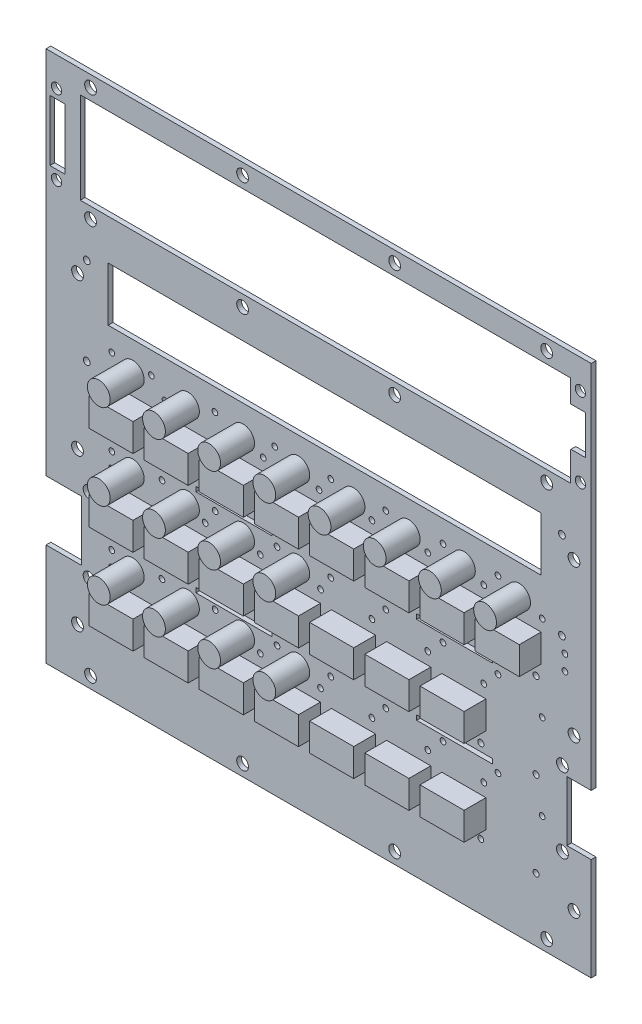
from build123d import *

# Parameters (mm, degrees)
SKETCH1_W                       = 144.56156
SKETCH1_H                       = 18.00098
SKETCH1_W_2                     = 5.08
SKETCH1_H_2                     = 20.32
SKETCH1_W_3                     = 25.4
SKETCH1_H_3                     = 1.5875
BOARD_DEPTH                     = 1.592072
SKETCH11_R                      = 3.81
LED_KINGBRIGHT_3P_2P54_10_DEPTH = 11.3538
SKETCH12_R                      = 3.81
LED_KINGBRIGHT_3P_2P54_11_DEPTH = 11.3538
SKETCH13_R                      = 3.81
LED_KINGBRIGHT_3P_2P54_12_DEPTH = 11.3538
SKETCH14_R                      = 3.81
LED_KINGBRIGHT_3P_2P54_13_DEPTH = 11.3538
SKETCH15_R                      = 3.81
LED_KINGBRIGHT_3P_2P54_14_DEPTH = 11.3538
SKETCH16_R                      = 3.81
LED_KINGBRIGHT_3P_2P54_15_DEPTH = 11.3538
SKETCH17_R                      = 3.81
LED_KINGBRIGHT_3P_2P54_16_DEPTH = 11.3538
SKETCH18_R                      = 3.81
LED_KINGBRIGHT_3P_2P54_17_DEPTH = 11.3538
SKETCH19_R                      = 3.81
LED_KINGBRIGHT_3P_2P54_18_DEPTH = 11.3538
SKETCH20_R                      = 3.81
LED_KINGBRIGHT_3P_2P54_19_DEPTH = 11.3538
SKETCH21_R                      = 3.81
LED_KINGBRIGHT_3P_2P54_20_DEPTH = 11.3538
SKETCH22_R                      = 3.81
LED_KINGBRIGHT_3P_2P54_21_DEPTH = 11.3538
SKETCH23_R                      = 3.81
LED_KINGBRIGHT_3P_2P54_22_DEPTH = 11.3538
SKETCH24_R                      = 3.81
LED_KINGBRIGHT_3P_2P54_23_DEPTH = 11.3538
SKETCH25_R                      = 3.81
LED_KINGBRIGHT_3P_2P54_24_DEPTH = 11.3538
SKETCH26_R                      = 3.81
LED_KINGBRIGHT_3P_2P54_25_DEPTH = 11.3538
SKETCH29_W                      = 14.732
SKETCH29_H                      = 9.271
SWITCH_MCDTS2_3_DEPTH           = 7.3000108
SKETCH30_W                      = 14.732
SKETCH30_H                      = 9.271
SWITCH_MCDTS2_4_DEPTH           = 7.3000108
SKETCH31_W                      = 14.732
SKETCH31_H                      = 9.271
SWITCH_MCDTS2_5_DEPTH           = 7.3000108
SKETCH32_W                      = 14.732
SKETCH32_H                      = 9.271
SWITCH_MCDTS2_6_DEPTH           = 7.3000108
SKETCH33_W                      = 14.732
SKETCH33_H                      = 9.271
SWITCH_MCDTS2_7_DEPTH           = 7.3000108
SKETCH34_W                      = 14.732
SKETCH34_H                      = 9.271
SWITCH_MCDTS2_8_DEPTH           = 7.3000108
SKETCH35_W                      = 14.732
SKETCH35_H                      = 9.271
SWITCH_MCDTS2_9_DEPTH           = 7.3000108
SKETCH36_W                      = 14.732
SKETCH36_H                      = 9.271
SWITCH_MCDTS2_10_DEPTH          = 7.3000108
SKETCH37_W                      = 14.732
SKETCH37_H                      = 9.271
SWITCH_MCDTS2_11_DEPTH          = 7.3000108
SKETCH38_W                      = 14.732
SKETCH38_H                      = 9.271
SWITCH_MCDTS2_12_DEPTH          = 7.3000108
SKETCH39_W                      = 14.732
SKETCH39_H                      = 9.271
SWITCH_MCDTS2_13_DEPTH          = 7.3000108
SKETCH40_W                      = 14.732
SKETCH40_H                      = 9.271
SWITCH_MCDTS2_14_DEPTH          = 7.3000108
SKETCH41_W                      = 14.732
SKETCH41_H                      = 9.271
SWITCH_MCDTS2_15_DEPTH          = 7.3000108
SKETCH42_W                      = 14.732
SKETCH42_H                      = 9.271
SWITCH_MCDTS2_16_DEPTH          = 7.3000108
SKETCH43_W                      = 14.732
SKETCH43_H                      = 9.271
SWITCH_MCDTS2_17_DEPTH          = 7.3000108
SKETCH44_W                      = 14.732
SKETCH44_H                      = 9.271
SWITCH_MCDTS2_18_DEPTH          = 7.3000108
SKETCH45_W                      = 14.732
SKETCH45_H                      = 9.271
SWITCH_MCDTS2_19_DEPTH          = 7.3000108
SKETCH46_W                      = 14.732
SKETCH46_H                      = 9.271
SWITCH_MCDTS2_20_DEPTH          = 7.3000108
SKETCH47_W                      = 14.732
SKETCH47_H                      = 9.271
SWITCH_MCDTS2_21_DEPTH          = 7.3000108
SKETCH48_W                      = 14.732
SKETCH48_H                      = 9.271
SWITCH_MCDTS2_22_DEPTH          = 7.3000108
SKETCH49_W                      = 14.732
SKETCH49_H                      = 9.271
SWITCH_MCDTS2_23_DEPTH          = 7.3000108
SKETCH50_W                      = 14.732
SKETCH50_H                      = 9.271
SWITCH_MCDTS2_24_DEPTH          = 7.3000108
SKETCH56_R                      = 1.016
SKETCH56_R_2                    = 0.9652
SKETCH56_R_3                    = 0.9525
SKETCH56_R_4                    = 1.9685
SKETCH56_R_5                    = 1.1303
SKETCH56_R_6                    = 1.7145
CUT_EXTRUDE1_DEPTH              = 10


with BuildPart() as part:
    # Sketch1 → BOARD (new body)
    with BuildSketch(Plane.XY):
        Polygon((0, 0), (182.118, 0), (182.118, 34.24682), (173.98746, 34.24682), (173.98746, 54.24678), (182.118, 54.24678), (182.118, 177.8), (0, 177.8), (0, 54.24678), (11.86942, 54.24678), (11.86942, 34.24682), (0, 34.24682), align=None)
        with Locations((93.01988, 117.17909)):
            Rectangle(SKETCH1_W, SKETCH1_H, mode=Mode.SUBTRACT)
        with Locations((3.81, 154.813)):
            Rectangle(SKETCH1_W_2, SKETCH1_H_2, mode=Mode.SUBTRACT)
        Polygon((12.7, 170.18), (175.26, 170.18), (175.26, 162.6616), (180.086, 162.6616), (180.2892, 162.4584), (180.2892, 149.606), (175.3616, 149.606), (175.26, 149.5044), (175.26, 139.7), (12.7, 139.7), (11.43, 139.7), (11.43, 170.18), align=None, mode=Mode.SUBTRACT)
        with Locations((62.7634, 46.20895)):
            Rectangle(SKETCH1_W_3, SKETCH1_H_3, mode=Mode.SUBTRACT)
        with Locations((136.5134176, 46.20895)):
            Rectangle(SKETCH1_W_3, SKETCH1_H_3, mode=Mode.SUBTRACT)
        with Locations((136.5134176, 75.41895)):
            Rectangle(SKETCH1_W_3, SKETCH1_H_3, mode=Mode.SUBTRACT)
        with Locations((62.7634, 75.41895)):
            Rectangle(SKETCH1_W_3, SKETCH1_H_3, mode=Mode.SUBTRACT)
    extrude(amount=BOARD_DEPTH)

    # Sketch56 → Cut-Extrude1 (cut)
    with BuildSketch(Plane.XY.offset(1.592072)):
        with Locations((163.703, 21.1074)):
            Circle(SKETCH56_R)
        with Locations((163.703, 49.6824)):
            Circle(SKETCH56_R)
        with Locations((145.2626, 21.8186)):
            Circle(SKETCH56_R_2)
        with Locations((126.8476, 21.6154)):
            Circle(SKETCH56_R_2)
        with Locations((108.4072, 21.7424)):
            Circle(SKETCH56_R_2)
        with Locations((89.9668, 21.844)):
            Circle(SKETCH56_R_2)
        with Locations((71.5264, 20.7772)):
            Circle(SKETCH56_R_2)
        with Locations((53.086, 21.1582)):
            Circle(SKETCH56_R_2)
        with Locations((34.6472002, 21.1328)):
            Circle(SKETCH56_R)
        with Locations((145.2626, 49.5554)):
            Circle(SKETCH56_R)
        with Locations((126.8222, 49.3522)):
            Circle(SKETCH56_R)
        with Locations((108.3818, 49.1236)):
            Circle(SKETCH56_R)
        with Locations((89.9414, 49.6824)):
            Circle(SKETCH56_R)
        with Locations((71.501, 49.1998)):
            Circle(SKETCH56_R)
        with Locations((53.0606, 49.1998)):
            Circle(SKETCH56_R)
        with Locations((34.6202, 49.276)):
            Circle(SKETCH56_R)
        with Locations((163.703, 78.2574)):
            Circle(SKETCH56_R)
        with Locations((145.2626, 77.7748)):
            Circle(SKETCH56_R)
        with Locations((126.746, 78.3336)):
            Circle(SKETCH56_R)
        with Locations((108.3818, 78.74)):
            Circle(SKETCH56_R)
        with Locations((89.9414, 78.3336)):
            Circle(SKETCH56_R)
        with Locations((71.501, 78.2574)):
            Circle(SKETCH56_R)
        with Locations((53.0606, 78.4098)):
            Circle(SKETCH56_R)
        with Locations((34.6202, 78.0542)):
            Circle(SKETCH56_R)
        with Locations((91.694, 38.6588)):
            Circle(SKETCH56_R_3)
        with Locations((77.1652, 43.7388)):
            Circle(SKETCH56_R_3)
        with Locations((71.5772, 38.6588)):
            Circle(SKETCH56_R_3)
        with Locations((56.4896, 43.7388)):
            Circle(SKETCH56_R_3)
        with Locations((38.735, 43.7388)):
            Circle(SKETCH56_R_3)
        with Locations((21.8948, 38.6588)):
            Circle(SKETCH56_R_3)
        with Locations((21.971, 43.7388)):
            Circle(SKETCH56_R_3)
        with Locations((77.1652, 72.3138)):
            Circle(SKETCH56_R_3)
        with Locations((91.694, 67.2338)):
            Circle(SKETCH56_R_3)
        with Locations((71.5772, 67.2338)):
            Circle(SKETCH56_R_3)
        with Locations((56.4896, 72.3138)):
            Circle(SKETCH56_R_3)
        with Locations((53.1368, 67.2338)):
            Circle(SKETCH56_R_3)
        with Locations((38.735, 72.3138)):
            Circle(SKETCH56_R_3)
        with Locations((21.8948, 67.2338)):
            Circle(SKETCH56_R_3)
        with Locations((21.971, 72.3138)):
            Circle(SKETCH56_R_3)
        with Locations((165.735, 95.8088)):
            Circle(SKETCH56_R_3)
        with Locations((150.9776, 100.8888)):
            Circle(SKETCH56_R_3)
        with Locations((146.2278, 95.8088)):
            Circle(SKETCH56_R_3)
        with Locations((132.6134, 100.8888)):
            Circle(SKETCH56_R_3)
        with Locations((113.4872, 100.8888)):
            Circle(SKETCH56_R_3)
        with Locations((127.508, 95.8088)):
            Circle(SKETCH56_R_3)
        with Locations((108.8644, 95.8088)):
            Circle(SKETCH56_R_3)
        with Locations((95.0976, 100.8888)):
            Circle(SKETCH56_R_3)
        with Locations((91.186, 95.8088)):
            Circle(SKETCH56_R_3)
        with Locations((76.3778, 100.8888)):
            Circle(SKETCH56_R_3)
        with Locations((72.5424, 95.8088)):
            Circle(SKETCH56_R_3)
        with Locations((56.4134, 100.8888)):
            Circle(SKETCH56_R_3)
        with Locations((39.7256, 95.8088)):
            Circle(SKETCH56_R_3)
        with Locations((35.179, 100.8888)):
            Circle(SKETCH56_R_3)
        with Locations((24.2062, 95.8088)):
            Circle(SKETCH56_R_3)
        with Locations((21.971, 100.8888)):
            Circle(SKETCH56_R_3)
        with Locations((132.6134, 72.3138)):
            Circle(SKETCH56_R_3)
        with Locations((146.2278, 67.2338)):
            Circle(SKETCH56_R_3)
        with Locations((113.4872, 72.3138)):
            Circle(SKETCH56_R_3)
        with Locations((127.508, 67.2338)):
            Circle(SKETCH56_R_3)
        with Locations((95.0976, 72.3138)):
            Circle(SKETCH56_R_3)
        with Locations((108.8644, 67.2338)):
            Circle(SKETCH56_R_3)
        with Locations((150.9776, 43.7388)):
            Circle(SKETCH56_R_3)
        with Locations((132.6134, 43.7388)):
            Circle(SKETCH56_R_3)
        with Locations((113.4872, 43.7388)):
            Circle(SKETCH56_R_3)
        with Locations((95.0976, 43.7388)):
            Circle(SKETCH56_R_3)
        with Locations((108.8644, 38.6588)):
            Circle(SKETCH56_R_3)
        with Locations((150.9776, 72.3138)):
            Circle(SKETCH56_R_3)
        with Locations((165.735, 67.2338)):
            Circle(SKETCH56_R_3)
        with Locations((173.3296, 89.4588)):
            Circle(SKETCH56_R_3)
        with Locations((173.355, 84.3534)):
            Circle(SKETCH56_R_3)
        with Locations((176.37252, 118.11)):
            Circle(SKETCH56_R_4)
        with Locations((176.37252, 67.31)):
            Circle(SKETCH56_R_4)
        with Locations((176.37252, 16.51)):
            Circle(SKETCH56_R_4)
        with Locations((167.259, 135.89)):
            Circle(SKETCH56_R_4)
        with Locations((116.459, 135.89)):
            Circle(SKETCH56_R_4)
        with Locations((65.659, 135.89)):
            Circle(SKETCH56_R_4)
        with Locations((14.859, 135.89)):
            Circle(SKETCH56_R_4)
        with Locations((10.51052, 118.11)):
            Circle(SKETCH56_R_4)
        with Locations((10.51052, 67.31)):
            Circle(SKETCH56_R_4)
        with Locations((10.51052, 16.51)):
            Circle(SKETCH56_R_4)
        with Locations((165.735, 38.6588)):
            Circle(SKETCH56_R_3)
        with Locations((146.2278, 38.6588)):
            Circle(SKETCH56_R_3)
        with Locations((127.508, 38.6588)):
            Circle(SKETCH56_R_3)
        with Locations((14.859, 173.99)):
            Circle(SKETCH56_R_4)
        with Locations((65.659, 173.99)):
            Circle(SKETCH56_R_4)
        with Locations((116.459, 173.99)):
            Circle(SKETCH56_R_4)
        with Locations((167.259, 173.99)):
            Circle(SKETCH56_R_4)
        with Locations((167.259, 3.81)):
            Circle(SKETCH56_R_4)
        with Locations((116.459, 3.81)):
            Circle(SKETCH56_R_4)
        with Locations((65.659, 3.81)):
            Circle(SKETCH56_R_4)
        with Locations((14.859, 3.81)):
            Circle(SKETCH56_R_4)
        with Locations((172.50664, 56.7436)):
            Circle(SKETCH56_R_4)
        with Locations((172.50664, 31.75)):
            Circle(SKETCH56_R_4)
        with Locations((14.36878, 56.7436)):
            Circle(SKETCH56_R_4)
        with Locations((14.36878, 31.75)):
            Circle(SKETCH56_R_4)
        with Locations((172.34154, 123.37542)):
            Circle(SKETCH56_R_5)
        with Locations((172.34154, 94.16542)):
            Circle(SKETCH56_R_5)
        with Locations((13.59154, 94.16542)):
            Circle(SKETCH56_R_5)
        with Locations((13.59154, 123.37542)):
            Circle(SKETCH56_R_5)
        with Locations((178.51374, 141.56182)):
            Circle(SKETCH56_R_6)
        with Locations((178.51374, 168.06164)):
            Circle(SKETCH56_R_6)
        with Locations((3.50012, 168.06164)):
            Circle(SKETCH56_R_6)
        with Locations((3.50012, 141.56182)):
            Circle(SKETCH56_R_6)
    extrude(amount=-CUT_EXTRUDE1_DEPTH, mode=Mode.SUBTRACT)


with BuildPart() as body_2:
    # Sketch11 → LED-KINGBRIGHT_3P_2P54-10 (new body)
    with BuildSketch(Plane.XY.offset(1.592072)):
        with Locations((84.2812132, 41.1988)):
            Circle(SKETCH11_R)
    extrude(amount=LED_KINGBRIGHT_3P_2P54_10_DEPTH)


with BuildPart() as body_3:
    # Sketch12 → LED-KINGBRIGHT_3P_2P54-11 (new body)
    with BuildSketch(Plane.XY.offset(1.592072)):
        with Locations((65.8437088, 41.1988)):
            Circle(SKETCH12_R)
    extrude(amount=LED_KINGBRIGHT_3P_2P54_11_DEPTH)


with BuildPart() as body_4:
    # Sketch13 → LED-KINGBRIGHT_3P_2P54-12 (new body)
    with BuildSketch(Plane.XY.offset(1.592072)):
        with Locations((47.4062044, 41.1988)):
            Circle(SKETCH13_R)
    extrude(amount=LED_KINGBRIGHT_3P_2P54_12_DEPTH)


with BuildPart() as body_5:
    # Sketch14 → LED-KINGBRIGHT_3P_2P54-13 (new body)
    with BuildSketch(Plane.XY.offset(1.592072)):
        with Locations((28.9687, 41.1988)):
            Circle(SKETCH14_R)
    extrude(amount=LED_KINGBRIGHT_3P_2P54_13_DEPTH)


with BuildPart() as body_6:
    # Sketch15 → LED-KINGBRIGHT_3P_2P54-14 (new body)
    with BuildSketch(Plane.XY.offset(1.592072)):
        with Locations((84.2812132, 69.7738)):
            Circle(SKETCH15_R)
    extrude(amount=LED_KINGBRIGHT_3P_2P54_14_DEPTH)


with BuildPart() as body_7:
    # Sketch16 → LED-KINGBRIGHT_3P_2P54-15 (new body)
    with BuildSketch(Plane.XY.offset(1.592072)):
        with Locations((65.8437088, 69.7738)):
            Circle(SKETCH16_R)
    extrude(amount=LED_KINGBRIGHT_3P_2P54_15_DEPTH)


with BuildPart() as body_8:
    # Sketch17 → LED-KINGBRIGHT_3P_2P54-16 (new body)
    with BuildSketch(Plane.XY.offset(1.592072)):
        with Locations((47.4062044, 69.7738)):
            Circle(SKETCH17_R)
    extrude(amount=LED_KINGBRIGHT_3P_2P54_16_DEPTH)


with BuildPart() as body_9:
    # Sketch18 → LED-KINGBRIGHT_3P_2P54-17 (new body)
    with BuildSketch(Plane.XY.offset(1.592072)):
        with Locations((28.9687, 69.7738)):
            Circle(SKETCH18_R)
    extrude(amount=LED_KINGBRIGHT_3P_2P54_17_DEPTH)


with BuildPart() as body_10:
    # Sketch19 → LED-KINGBRIGHT_3P_2P54-18 (new body)
    with BuildSketch(Plane.XY.offset(1.592072)):
        with Locations((158.0312308, 98.3488)):
            Circle(SKETCH19_R)
    extrude(amount=LED_KINGBRIGHT_3P_2P54_18_DEPTH)


with BuildPart() as body_11:
    # Sketch20 → LED-KINGBRIGHT_3P_2P54-19 (new body)
    with BuildSketch(Plane.XY.offset(1.592072)):
        with Locations((139.5937264, 98.3488)):
            Circle(SKETCH20_R)
    extrude(amount=LED_KINGBRIGHT_3P_2P54_19_DEPTH)


with BuildPart() as body_12:
    # Sketch21 → LED-KINGBRIGHT_3P_2P54-20 (new body)
    with BuildSketch(Plane.XY.offset(1.592072)):
        with Locations((121.156222, 98.3488)):
            Circle(SKETCH21_R)
    extrude(amount=LED_KINGBRIGHT_3P_2P54_20_DEPTH)


with BuildPart() as body_13:
    # Sketch22 → LED-KINGBRIGHT_3P_2P54-21 (new body)
    with BuildSketch(Plane.XY.offset(1.592072)):
        with Locations((102.7187176, 98.3488)):
            Circle(SKETCH22_R)
    extrude(amount=LED_KINGBRIGHT_3P_2P54_21_DEPTH)


with BuildPart() as body_14:
    # Sketch23 → LED-KINGBRIGHT_3P_2P54-22 (new body)
    with BuildSketch(Plane.XY.offset(1.592072)):
        with Locations((84.2812132, 98.3488)):
            Circle(SKETCH23_R)
    extrude(amount=LED_KINGBRIGHT_3P_2P54_22_DEPTH)


with BuildPart() as body_15:
    # Sketch24 → LED-KINGBRIGHT_3P_2P54-23 (new body)
    with BuildSketch(Plane.XY.offset(1.592072)):
        with Locations((65.8437088, 98.3488)):
            Circle(SKETCH24_R)
    extrude(amount=LED_KINGBRIGHT_3P_2P54_23_DEPTH)


with BuildPart() as body_16:
    # Sketch25 → LED-KINGBRIGHT_3P_2P54-24 (new body)
    with BuildSketch(Plane.XY.offset(1.592072)):
        with Locations((47.4062044, 98.3488)):
            Circle(SKETCH25_R)
    extrude(amount=LED_KINGBRIGHT_3P_2P54_24_DEPTH)


with BuildPart() as body_17:
    # Sketch26 → LED-KINGBRIGHT_3P_2P54-25 (new body)
    with BuildSketch(Plane.XY.offset(1.592072)):
        with Locations((28.9687, 98.3488)):
            Circle(SKETCH26_R)
    extrude(amount=LED_KINGBRIGHT_3P_2P54_25_DEPTH)


with BuildPart() as body_18:
    # Sketch29 → SWITCH-MCDTS2-3 (new body)
    with BuildSketch(Plane.XY.offset(1.592072)):
        with Locations((139.5937264, 29.9593)):
            Rectangle(SKETCH29_W, SKETCH29_H)
    extrude(amount=SWITCH_MCDTS2_3_DEPTH)


with BuildPart() as body_19:
    # Sketch30 → SWITCH-MCDTS2-4 (new body)
    with BuildSketch(Plane.XY.offset(1.592072)):
        with Locations((121.156222, 29.9593)):
            Rectangle(SKETCH30_W, SKETCH30_H)
    extrude(amount=SWITCH_MCDTS2_4_DEPTH)


with BuildPart() as body_20:
    # Sketch31 → SWITCH-MCDTS2-5 (new body)
    with BuildSketch(Plane.XY.offset(1.592072)):
        with Locations((102.7187176, 29.9593)):
            Rectangle(SKETCH31_W, SKETCH31_H)
    extrude(amount=SWITCH_MCDTS2_5_DEPTH)


with BuildPart() as body_21:
    # Sketch32 → SWITCH-MCDTS2-6 (new body)
    with BuildSketch(Plane.XY.offset(1.592072)):
        with Locations((84.2812132, 29.9593)):
            Rectangle(SKETCH32_W, SKETCH32_H)
    extrude(amount=SWITCH_MCDTS2_6_DEPTH)


with BuildPart() as body_22:
    # Sketch33 → SWITCH-MCDTS2-7 (new body)
    with BuildSketch(Plane.XY.offset(1.592072)):
        with Locations((65.8437088, 29.9593)):
            Rectangle(SKETCH33_W, SKETCH33_H)
    extrude(amount=SWITCH_MCDTS2_7_DEPTH)


with BuildPart() as body_23:
    # Sketch34 → SWITCH-MCDTS2-8 (new body)
    with BuildSketch(Plane.XY.offset(1.592072)):
        with Locations((47.4062044, 29.9593)):
            Rectangle(SKETCH34_W, SKETCH34_H)
    extrude(amount=SWITCH_MCDTS2_8_DEPTH)


with BuildPart() as body_24:
    # Sketch35 → SWITCH-MCDTS2-9 (new body)
    with BuildSketch(Plane.XY.offset(1.592072)):
        with Locations((28.9687, 29.9593)):
            Rectangle(SKETCH35_W, SKETCH35_H)
    extrude(amount=SWITCH_MCDTS2_9_DEPTH)


with BuildPart() as body_25:
    # Sketch36 → SWITCH-MCDTS2-10 (new body)
    with BuildSketch(Plane.XY.offset(1.592072)):
        with Locations((139.5937264, 58.5343)):
            Rectangle(SKETCH36_W, SKETCH36_H)
    extrude(amount=SWITCH_MCDTS2_10_DEPTH)


with BuildPart() as body_26:
    # Sketch37 → SWITCH-MCDTS2-11 (new body)
    with BuildSketch(Plane.XY.offset(1.592072)):
        with Locations((121.156222, 58.5343)):
            Rectangle(SKETCH37_W, SKETCH37_H)
    extrude(amount=SWITCH_MCDTS2_11_DEPTH)


with BuildPart() as body_27:
    # Sketch38 → SWITCH-MCDTS2-12 (new body)
    with BuildSketch(Plane.XY.offset(1.592072)):
        with Locations((102.7187176, 58.5343)):
            Rectangle(SKETCH38_W, SKETCH38_H)
    extrude(amount=SWITCH_MCDTS2_12_DEPTH)


with BuildPart() as body_28:
    # Sketch39 → SWITCH-MCDTS2-13 (new body)
    with BuildSketch(Plane.XY.offset(1.592072)):
        with Locations((84.2812132, 58.5343)):
            Rectangle(SKETCH39_W, SKETCH39_H)
    extrude(amount=SWITCH_MCDTS2_13_DEPTH)


with BuildPart() as body_29:
    # Sketch40 → SWITCH-MCDTS2-14 (new body)
    with BuildSketch(Plane.XY.offset(1.592072)):
        with Locations((65.8437088, 58.5343)):
            Rectangle(SKETCH40_W, SKETCH40_H)
    extrude(amount=SWITCH_MCDTS2_14_DEPTH)


with BuildPart() as body_30:
    # Sketch41 → SWITCH-MCDTS2-15 (new body)
    with BuildSketch(Plane.XY.offset(1.592072)):
        with Locations((47.4062044, 58.5343)):
            Rectangle(SKETCH41_W, SKETCH41_H)
    extrude(amount=SWITCH_MCDTS2_15_DEPTH)


with BuildPart() as body_31:
    # Sketch42 → SWITCH-MCDTS2-16 (new body)
    with BuildSketch(Plane.XY.offset(1.592072)):
        with Locations((28.9687, 58.5343)):
            Rectangle(SKETCH42_W, SKETCH42_H)
    extrude(amount=SWITCH_MCDTS2_16_DEPTH)


with BuildPart() as body_32:
    # Sketch43 → SWITCH-MCDTS2-17 (new body)
    with BuildSketch(Plane.XY.offset(1.592072)):
        with Locations((158.0312308, 87.1093)):
            Rectangle(SKETCH43_W, SKETCH43_H)
    extrude(amount=SWITCH_MCDTS2_17_DEPTH)


with BuildPart() as body_33:
    # Sketch44 → SWITCH-MCDTS2-18 (new body)
    with BuildSketch(Plane.XY.offset(1.592072)):
        with Locations((139.5937264, 87.1093)):
            Rectangle(SKETCH44_W, SKETCH44_H)
    extrude(amount=SWITCH_MCDTS2_18_DEPTH)


with BuildPart() as body_34:
    # Sketch45 → SWITCH-MCDTS2-19 (new body)
    with BuildSketch(Plane.XY.offset(1.592072)):
        with Locations((121.156222, 87.1093)):
            Rectangle(SKETCH45_W, SKETCH45_H)
    extrude(amount=SWITCH_MCDTS2_19_DEPTH)


with BuildPart() as body_35:
    # Sketch46 → SWITCH-MCDTS2-20 (new body)
    with BuildSketch(Plane.XY.offset(1.592072)):
        with Locations((102.7187176, 87.1093)):
            Rectangle(SKETCH46_W, SKETCH46_H)
    extrude(amount=SWITCH_MCDTS2_20_DEPTH)


with BuildPart() as body_36:
    # Sketch47 → SWITCH-MCDTS2-21 (new body)
    with BuildSketch(Plane.XY.offset(1.592072)):
        with Locations((84.2812132, 87.1093)):
            Rectangle(SKETCH47_W, SKETCH47_H)
    extrude(amount=SWITCH_MCDTS2_21_DEPTH)


with BuildPart() as body_37:
    # Sketch48 → SWITCH-MCDTS2-22 (new body)
    with BuildSketch(Plane.XY.offset(1.592072)):
        with Locations((65.8437088, 87.1093)):
            Rectangle(SKETCH48_W, SKETCH48_H)
    extrude(amount=SWITCH_MCDTS2_22_DEPTH)


with BuildPart() as body_38:
    # Sketch49 → SWITCH-MCDTS2-23 (new body)
    with BuildSketch(Plane.XY.offset(1.592072)):
        with Locations((47.4062044, 87.1093)):
            Rectangle(SKETCH49_W, SKETCH49_H)
    extrude(amount=SWITCH_MCDTS2_23_DEPTH)


with BuildPart() as body_39:
    # Sketch50 → SWITCH-MCDTS2-24 (new body)
    with BuildSketch(Plane.XY.offset(1.592072)):
        with Locations((28.9687, 87.1093)):
            Rectangle(SKETCH50_W, SKETCH50_H)
    extrude(amount=SWITCH_MCDTS2_24_DEPTH)


solid = Compound([part.part, body_2.part, body_3.part, body_4.part, body_5.part, body_6.part, body_7.part, body_8.part, body_9.part, body_10.part, body_11.part, body_12.part, body_13.part, body_14.part, body_15.part, body_16.part, body_17.part, body_18.part, body_19.part, body_20.part, body_21.part, body_22.part, body_23.part, body_24.part, body_25.part, body_26.part, body_27.part, body_28.part, body_29.part, body_30.part, body_31.part, body_32.part, body_33.part, body_34.part, body_35.part, body_36.part, body_37.part, body_38.part, body_39.part])
